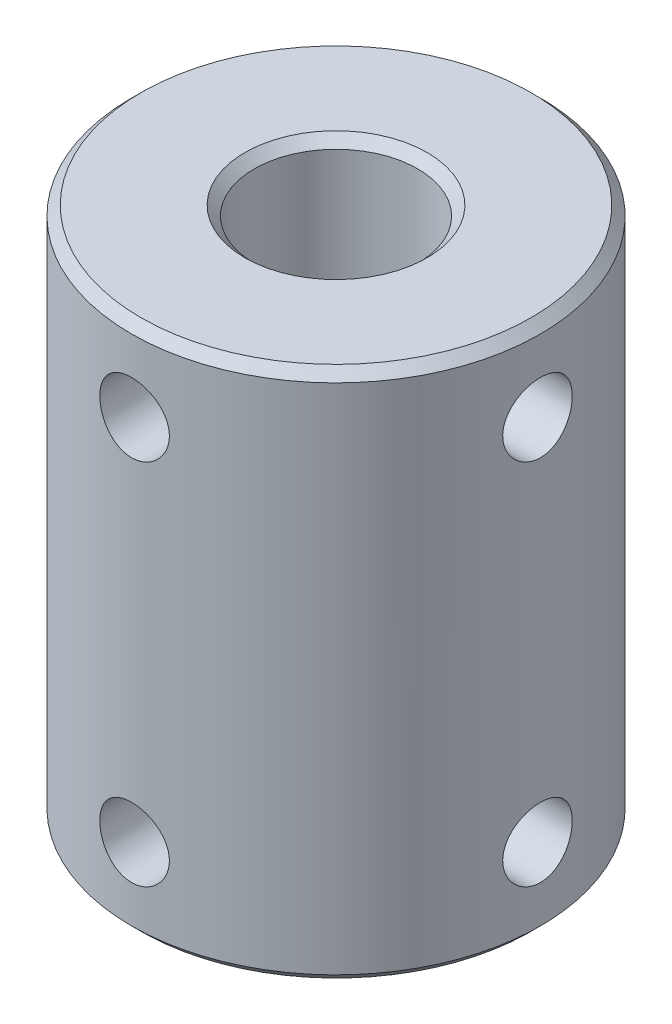
from build123d import *

# Parameters (mm, degrees)
CROQUIS1_W                           = 10
CROQUIS1_H                           = 26
TALADRO_ROSCADO_M8X1_01_D            = 5
TALADRO_ROSCADO_M8X1_01_CBORE_D      = 8
TALADRO_ROSCADO_M8X1_01_CBORE_DEPTH  = 18.5
DI_METRO_DE_TALADRO_3_4_3_4_1_REACH  = 33.369
DI_METRO_DE_TALADRO_3_4_3_4_1_BORE_R = 1.7
DI_METRO_DE_TALADRO_3_4_3_4_2_REACH  = 33.369
DI_METRO_DE_TALADRO_3_4_3_4_2_BORE_R = 1.7
DI_METRO_DE_TALADRO_3_4_3_4_3_REACH  = 33.369
DI_METRO_DE_TALADRO_3_4_3_4_3_BORE_R = 1.7
DI_METRO_DE_TALADRO_3_4_3_4_4_REACH  = 33.369
DI_METRO_DE_TALADRO_3_4_3_4_4_BORE_R = 1.7
CHAFL_N1_SIZE                        = 0.46


with BuildPart() as part:
    # Croquis1 → Revolución1 (revolve)
    with BuildSketch(Plane(origin=(0, 0, 0), x_dir=(-1, 0, 0), z_dir=(0, 0, -1)), mode=Mode.PRIVATE) as revoluci_n1_sk:
        with Locations((-5, 0)):
            Rectangle(CROQUIS1_W, CROQUIS1_H)
    revolve(revoluci_n1_sk.sketch.rotate(Axis((0, -13, 0), (0, 1, 0)), 270), axis=Axis((0, -13, 0), (0, 1, 0)))

    # Taladro roscado M8x1.01 (through all)
    with Locations(Plane(origin=(0, 13, 0), x_dir=(1, 0, 0), z_dir=(0, 1, 0))):
        with Locations((0, 0)):
            CounterBoreHole(TALADRO_ROSCADO_M8X1_01_D / 2, TALADRO_ROSCADO_M8X1_01_CBORE_D / 2, TALADRO_ROSCADO_M8X1_01_CBORE_DEPTH)

    # Diámetro de taladro Ø3.4 (3.4)1 bore (on position points) → Diámetro de taladro Ø3.4 (3.4)1 (cut, up to next)
    with BuildSketch(Plane(origin=(0, -9, 10), x_dir=(1, 0, 0), z_dir=(0, 0, 1)), mode=Mode.PRIVATE) as di_metro_de_taladro_3_4_3_4_1_sk1:
        Circle(DI_METRO_DE_TALADRO_3_4_3_4_1_BORE_R)
    di_metro_de_taladro_3_4_3_4_1_tool1 = extrude(di_metro_de_taladro_3_4_3_4_1_sk1.sketch, amount=-DI_METRO_DE_TALADRO_3_4_3_4_1_REACH, mode=Mode.PRIVATE) & part.part
    add(di_metro_de_taladro_3_4_3_4_1_tool1.solids().sort_by_distance((0, -9, 10))[0], mode=Mode.SUBTRACT)

    # Diámetro de taladro Ø3.4 (3.4)2 bore (on position points) → Diámetro de taladro Ø3.4 (3.4)2 (cut, up to next)
    with BuildSketch(Plane(origin=(10, -9, 0), x_dir=(0, 0, 1), z_dir=(1, 0, 0)), mode=Mode.PRIVATE) as di_metro_de_taladro_3_4_3_4_2_sk1:
        Circle(DI_METRO_DE_TALADRO_3_4_3_4_2_BORE_R)
    di_metro_de_taladro_3_4_3_4_2_tool1 = extrude(di_metro_de_taladro_3_4_3_4_2_sk1.sketch, amount=-DI_METRO_DE_TALADRO_3_4_3_4_2_REACH, mode=Mode.PRIVATE) & part.part
    add(di_metro_de_taladro_3_4_3_4_2_tool1.solids().sort_by_distance((10, -9, 0))[0], mode=Mode.SUBTRACT)

    # Diámetro de taladro Ø3.4 (3.4)3 bore (on position points) → Diámetro de taladro Ø3.4 (3.4)3 (cut, up to next)
    with BuildSketch(Plane(origin=(0, 9, 10), x_dir=(1, 0, 0), z_dir=(0, 0, 1)), mode=Mode.PRIVATE) as di_metro_de_taladro_3_4_3_4_3_sk1:
        Circle(DI_METRO_DE_TALADRO_3_4_3_4_3_BORE_R)
    di_metro_de_taladro_3_4_3_4_3_tool1 = extrude(di_metro_de_taladro_3_4_3_4_3_sk1.sketch, amount=-DI_METRO_DE_TALADRO_3_4_3_4_3_REACH, mode=Mode.PRIVATE) & part.part
    add(di_metro_de_taladro_3_4_3_4_3_tool1.solids().sort_by_distance((0, 9, 10))[0], mode=Mode.SUBTRACT)

    # Diámetro de taladro Ø3.4 (3.4)4 bore (on position points) → Diámetro de taladro Ø3.4 (3.4)4 (cut, up to next)
    with BuildSketch(Plane(origin=(10, 9, 0), x_dir=(0, 0, 1), z_dir=(1, 0, 0)), mode=Mode.PRIVATE) as di_metro_de_taladro_3_4_3_4_4_sk1:
        Circle(DI_METRO_DE_TALADRO_3_4_3_4_4_BORE_R)
    di_metro_de_taladro_3_4_3_4_4_tool1 = extrude(di_metro_de_taladro_3_4_3_4_4_sk1.sketch, amount=-DI_METRO_DE_TALADRO_3_4_3_4_4_REACH, mode=Mode.PRIVATE) & part.part
    add(di_metro_de_taladro_3_4_3_4_4_tool1.solids().sort_by_distance((10, 9, 0))[0], mode=Mode.SUBTRACT)

    # Chaflán1
    chafl_n1_edges = [part.edges().sort_by_distance(p)[0] for p in [
        (-4, 13, 0),
        (2.5, -13, 0),
        (0, 13, -10),
        (0, -13, -10),
    ]]
    chamfer(chafl_n1_edges, length=CHAFL_N1_SIZE)


solid = part.part
